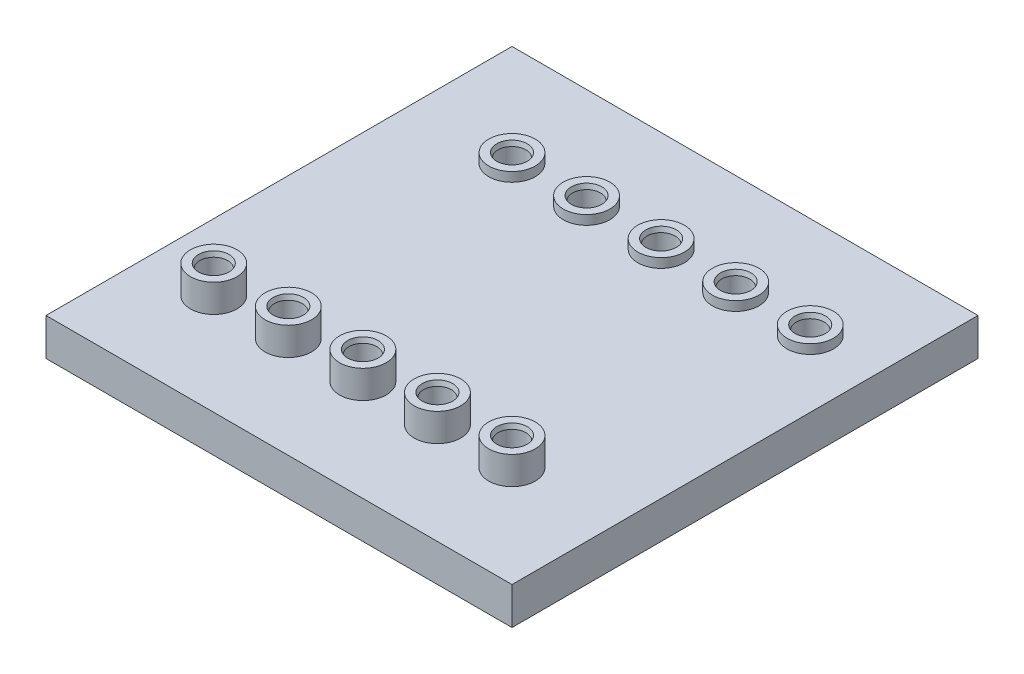
from build123d import *

# Parameters (mm, degrees)
SKETCH1_W                                      = 50
SKETCH1_H                                      = 50
BOSS_EXTRUDE2_DEPTH                            = 4
BOSS_EXTRUDE3_START                            = 4
SKETCH1_4_R                                    = 2.5
BOSS_EXTRUDE3_DEPTH                            = 1
BOSS_EXTRUDE4_START                            = 4
SKETCH1_5_R                                    = 2.5
BOSS_EXTRUDE4_DEPTH                            = 3
CSK_FOR_M2_FLAT_HEAD_MACHINE_SCREW1_AT_2_COUNT = 2
CSK_FOR_M2_FLAT_HEAD_MACHINE_SCREW1_AT_2_PITCH = 8
CSK_FOR_M2_FLAT_HEAD_MACHINE_SCREW1_AT_3_COUNT = 2
CSK_FOR_M2_FLAT_HEAD_MACHINE_SCREW1_AT_3_PITCH = 16
CSK_FOR_M2_FLAT_HEAD_MACHINE_SCREW1_AT_4_COUNT = 2
CSK_FOR_M2_FLAT_HEAD_MACHINE_SCREW1_AT_4_PITCH = 24
CSK_FOR_M2_FLAT_HEAD_MACHINE_SCREW1_AT_5_COUNT = 2
CSK_FOR_M2_FLAT_HEAD_MACHINE_SCREW1_AT_5_PITCH = 32
CSK_FOR_M2_FLAT_HEAD_MACHINE_SCREW2_AT_2_COUNT = 2
CSK_FOR_M2_FLAT_HEAD_MACHINE_SCREW2_AT_2_PITCH = 32
CSK_FOR_M2_FLAT_HEAD_MACHINE_SCREW2_AT_3_COUNT = 2
CSK_FOR_M2_FLAT_HEAD_MACHINE_SCREW2_AT_3_PITCH = 24
CSK_FOR_M2_FLAT_HEAD_MACHINE_SCREW2_AT_4_COUNT = 2
CSK_FOR_M2_FLAT_HEAD_MACHINE_SCREW2_AT_4_PITCH = 16
CSK_FOR_M2_FLAT_HEAD_MACHINE_SCREW2_AT_5_COUNT = 2
CSK_FOR_M2_FLAT_HEAD_MACHINE_SCREW2_AT_5_PITCH = 8


with BuildPart() as part:
    # Sketch1 → Boss-Extrude2 (new body)
    with BuildSketch(Plane(origin=(0, 0, 0), x_dir=(1, 0, 0), z_dir=(0, 1, 0))):
        Rectangle(SKETCH1_W, SKETCH1_H)
    extrude(amount=BOSS_EXTRUDE2_DEPTH)

    # Sketch1<4> → Boss-Extrude3 (add)
    with BuildSketch(Plane(origin=(0, 0, 0), x_dir=(1, 0, 0), z_dir=(0, 1, 0)).offset(BOSS_EXTRUDE3_START)):
        with Locations(Location((-14.142135624, 14.142135624, 0), (0, 0, 90))):
            Circle(SKETCH1_4_R)
        with Locations(Location((-6.142135624, 14.142135624, 0), (0, 0, 90))):
            Circle(SKETCH1_4_R)
        with Locations(Location((9.857864376, 14.142135624, 0), (0, 0, 90))):
            Circle(SKETCH1_4_R)
        with Locations(Location((17.857864376, 14.142135624, 0), (0, 0, 90))):
            Circle(SKETCH1_4_R)
        with Locations(Location((1.857864376, 14.142135624, 0), (0, 0, 90))):
            Circle(SKETCH1_4_R)
    extrude(amount=BOSS_EXTRUDE3_DEPTH)

    # Sketch1<5> → Boss-Extrude4 (add)
    with BuildSketch(Plane(origin=(0, 0, 0), x_dir=(1, 0, 0), z_dir=(0, 1, 0)).offset(BOSS_EXTRUDE4_START)):
        with Locations(Location((14.142135624, -14.142135624, 0), (0, 0, 90))):
            Circle(SKETCH1_5_R)
        with Locations(Location((6.142135624, -14.142135624, 0), (0, 0, 90))):
            Circle(SKETCH1_5_R)
        with Locations(Location((-1.857864376, -14.142135624, 0), (0, 0, 90))):
            Circle(SKETCH1_5_R)
        with Locations(Location((-9.857864376, -14.142135624, 0), (0, 0, 90))):
            Circle(SKETCH1_5_R)
        with Locations(Location((-17.857864376, -14.142135624, 0), (0, 0, 90))):
            Circle(SKETCH1_5_R)
    extrude(amount=BOSS_EXTRUDE4_DEPTH)

    # Sketch3 → CSK for M2 Flat Head Machine Screw1 (revolve, cut)
    with BuildSketch(Plane(origin=(-14.142135624, 5, -14.142135624), x_dir=(0, 0, 1), z_dir=(1, 0, 0))):
        Polygon((0, 0), (0, 3.5), (1.5, 3.5), (1.5, 0.503826859), (1.635, 0), align=None)
    csk_for_m2_flat_head_machine_screw1 = revolve(axis=Axis((-14.142135624, 11.35, -14.142135624), (0, -1, 0)), mode=Mode.SUBTRACT)

    # CSK for M2 Flat Head Machine Screw1 at 2: CSK for M2 Flat Head Machine Screw1 ×2
    with Locations(*[(i * CSK_FOR_M2_FLAT_HEAD_MACHINE_SCREW1_AT_2_PITCH, 0, 0) for i in range(1, CSK_FOR_M2_FLAT_HEAD_MACHINE_SCREW1_AT_2_COUNT)]):
        add(csk_for_m2_flat_head_machine_screw1, mode=Mode.SUBTRACT)

    # CSK for M2 Flat Head Machine Screw1 at 3: CSK for M2 Flat Head Machine Screw1 ×2
    with Locations(*[(i * CSK_FOR_M2_FLAT_HEAD_MACHINE_SCREW1_AT_3_PITCH, 0, 0) for i in range(1, CSK_FOR_M2_FLAT_HEAD_MACHINE_SCREW1_AT_3_COUNT)]):
        add(csk_for_m2_flat_head_machine_screw1, mode=Mode.SUBTRACT)

    # CSK for M2 Flat Head Machine Screw1 at 4: CSK for M2 Flat Head Machine Screw1 ×2
    with Locations(*[(i * CSK_FOR_M2_FLAT_HEAD_MACHINE_SCREW1_AT_4_PITCH, 0, 0) for i in range(1, CSK_FOR_M2_FLAT_HEAD_MACHINE_SCREW1_AT_4_COUNT)]):
        add(csk_for_m2_flat_head_machine_screw1, mode=Mode.SUBTRACT)

    # CSK for M2 Flat Head Machine Screw1 at 5: CSK for M2 Flat Head Machine Screw1 ×2
    with Locations(*[(i * CSK_FOR_M2_FLAT_HEAD_MACHINE_SCREW1_AT_5_PITCH, 0, 0) for i in range(1, CSK_FOR_M2_FLAT_HEAD_MACHINE_SCREW1_AT_5_COUNT)]):
        add(csk_for_m2_flat_head_machine_screw1, mode=Mode.SUBTRACT)

    # Sketch5 → CSK for M2 Flat Head Machine Screw2 (revolve, cut)
    with BuildSketch(Plane(origin=(14.142135624, 7, 14.142135624), x_dir=(0, 0, 1), z_dir=(1, 0, 0))):
        Polygon((0, 0), (0, 6), (1.5, 6), (1.5, 0.503826859), (1.635, 0), align=None)
    csk_for_m2_flat_head_machine_screw2 = revolve(axis=Axis((14.142135624, 13.35, 14.142135624), (0, -1, 0)), mode=Mode.SUBTRACT)

    # CSK for M2 Flat Head Machine Screw2 at 2: CSK for M2 Flat Head Machine Screw2 ×2
    with Locations(*[(-i * CSK_FOR_M2_FLAT_HEAD_MACHINE_SCREW2_AT_2_PITCH, 0, 0) for i in range(1, CSK_FOR_M2_FLAT_HEAD_MACHINE_SCREW2_AT_2_COUNT)]):
        add(csk_for_m2_flat_head_machine_screw2, mode=Mode.SUBTRACT)

    # CSK for M2 Flat Head Machine Screw2 at 3: CSK for M2 Flat Head Machine Screw2 ×2
    with Locations(*[(-i * CSK_FOR_M2_FLAT_HEAD_MACHINE_SCREW2_AT_3_PITCH, 0, 0) for i in range(1, CSK_FOR_M2_FLAT_HEAD_MACHINE_SCREW2_AT_3_COUNT)]):
        add(csk_for_m2_flat_head_machine_screw2, mode=Mode.SUBTRACT)

    # CSK for M2 Flat Head Machine Screw2 at 4: CSK for M2 Flat Head Machine Screw2 ×2
    with Locations(*[(-i * CSK_FOR_M2_FLAT_HEAD_MACHINE_SCREW2_AT_4_PITCH, 0, 0) for i in range(1, CSK_FOR_M2_FLAT_HEAD_MACHINE_SCREW2_AT_4_COUNT)]):
        add(csk_for_m2_flat_head_machine_screw2, mode=Mode.SUBTRACT)

    # CSK for M2 Flat Head Machine Screw2 at 5: CSK for M2 Flat Head Machine Screw2 ×2
    with Locations(*[(-i * CSK_FOR_M2_FLAT_HEAD_MACHINE_SCREW2_AT_5_PITCH, 0, 0) for i in range(1, CSK_FOR_M2_FLAT_HEAD_MACHINE_SCREW2_AT_5_COUNT)]):
        add(csk_for_m2_flat_head_machine_screw2, mode=Mode.SUBTRACT)


solid = part.part
